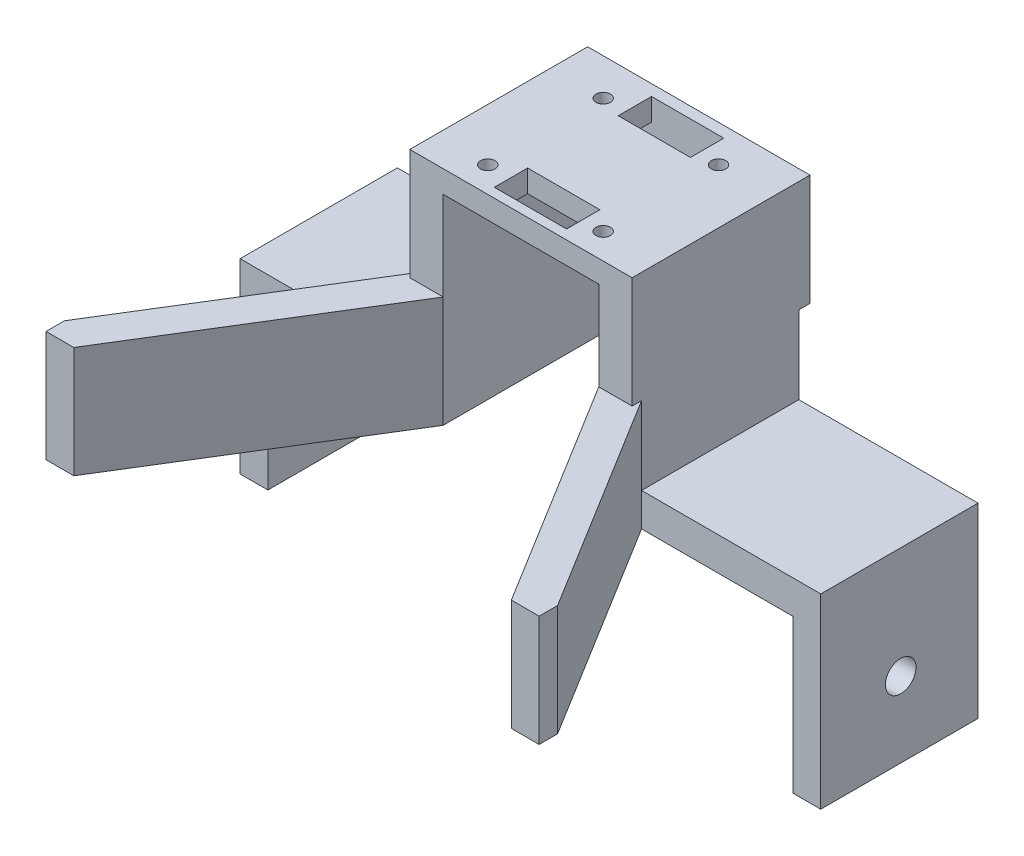
from build123d import *

# Parameters (mm, degrees)
BOSS_EXTRUDE1_DEPTH  = 25.4
SKETCH7_W            = 35.937578614
SKETCH7_H            = 7.62
BOSS_EXTRUDE3_DEPTH  = 40.95
SKETCH8_W            = 6.35
SKETCH8_H            = 35.937578614
BOSS_EXTRUDE4_DEPTH  = 35
SKETCH9_W            = 7.62
SKETCH9_H            = 35.937578614
BOSS_EXTRUDE5_DEPTH  = 25.4
BOSS_EXTRUDE6_REACH  = 135.462
SKETCH10_W           = 35.937578614
SKETCH10_H           = 5.08
CUT_EXTRUDE1_REACH   = 172.448
SKETCH11_W           = 16.51
SKETCH11_H           = 7.62
BOSS_EXTRUDE7_DEPTH  = 2.162419
SKETCH14_W           = 50.8
SKETCH14_H           = 25.4
BOSS_EXTRUDE9_DEPTH  = 2.54
M6_CLEARANCE_HOLE2_D = 7
CUT_EXTRUDE2_REACH   = 171.327
SKETCH18_R           = 1.651
SKETCH19_W           = 7.62
SKETCH19_H           = 16.51
CUT_EXTRUDE4_DEPTH   = 1.27


with BuildPart() as part:
    # Sketch1 → Boss-Extrude1 (new body)
    with BuildSketch(Plane(origin=(0, 0, 0), x_dir=(1, 0, 0), z_dir=(0, 1, 0))):
        Polygon((6.35, 4.219850082), (-24.6, 54.359549401), (-24.6, 90.297128015), (-32.22, 90.297128015), (-32.22, 52.197128015), (0, 0), (6.35, 0), align=None)
    extrude(amount=BOSS_EXTRUDE1_DEPTH)

    # Sketch7 → Boss-Extrude3 (add)
    with BuildSketch(Plane(origin=(-24.6, 0, 0), x_dir=(0, 0, -1), z_dir=(1, 0, 0))):
        with Locations((72.328338708, 3.81)):
            Rectangle(SKETCH7_W, SKETCH7_H)
    extrude(amount=BOSS_EXTRUDE3_DEPTH)

    # Sketch8 → Boss-Extrude4 (add)
    with BuildSketch(Plane.XZ):
        with Locations((13.175, -72.328338708)):
            Rectangle(SKETCH8_W, SKETCH8_H)
    extrude(amount=BOSS_EXTRUDE4_DEPTH)


with BuildPart() as body_2:
    # Mirror6: mirrored copy
    add(part.part.mirror(Plane.ZY.offset(50)))


with BuildPart() as part_1:
    add(part.part)

    add(body_2.part)  # Boss-Extrude5 merges body 2
    # Sketch9 → Boss-Extrude5 (add)
    with BuildSketch(Plane(origin=(0, 25.4, 0), x_dir=(1, 0, 0), z_dir=(0, 1, 0))):
        with Locations((-71.59, 72.328338708)):
            Rectangle(SKETCH9_W, SKETCH9_H)
        with Locations((-28.41, 72.328338708)):
            Rectangle(SKETCH9_W, SKETCH9_H)
    extrude(amount=BOSS_EXTRUDE5_DEPTH)

    # Sketch10 → Boss-Extrude6 (add, up to next)
    with BuildSketch(Plane(origin=(-67.78, 0, 0), x_dir=(0, 0, -1), z_dir=(1, 0, 0)), mode=Mode.PRIVATE) as boss_extrude6_sk1:
        with Locations((72.328338708, 48.26)):
            Rectangle(SKETCH10_W, SKETCH10_H)
    boss_extrude6_tool1 = extrude(boss_extrude6_sk1.sketch, amount=BOSS_EXTRUDE6_REACH, mode=Mode.PRIVATE) - part_1.part
    add(boss_extrude6_tool1.solids().sort_by_distance((-67.78, 48.26, -72.328339))[0])

    # Sketch11 → Cut-Extrude1 (cut, up to next)
    with BuildSketch(Plane(origin=(0, 50.8, 0), x_dir=(1, 0, 0), z_dir=(0, 1, 0)), mode=Mode.PRIVATE) as cut_extrude1_sk1:
        with Locations((-50, 58.169549401)):
            Rectangle(SKETCH11_W, SKETCH11_H)
    cut_extrude1_tool1 = extrude(cut_extrude1_sk1.sketch, amount=-CUT_EXTRUDE1_REACH, mode=Mode.PRIVATE) & part_1.part
    # Sketch11 → Cut-Extrude1 (cut, up to next)
    with BuildSketch(Plane(origin=(0, 50.8, 0), x_dir=(1, 0, 0), z_dir=(0, 1, 0)), mode=Mode.PRIVATE) as cut_extrude1_sk2:
        with Locations((-50, 86.487128015)):
            Rectangle(SKETCH11_W, SKETCH11_H)
    cut_extrude1_tool2 = extrude(cut_extrude1_sk2.sketch, amount=-CUT_EXTRUDE1_REACH, mode=Mode.PRIVATE) & part_1.part
    add(cut_extrude1_tool1.solids().sort_by_distance((-50, 50.8, -58.169549))[0], mode=Mode.SUBTRACT)
    add(cut_extrude1_tool2.solids().sort_by_distance((-50, 50.8, -86.487128))[0], mode=Mode.SUBTRACT)

    # Sketch12 → Boss-Extrude7 (add)
    with BuildSketch(Plane.XY.offset(-54.359549401)):
        Polygon((-75.4, 50.8), (-24.6, 50.8), (-24.6, 25.4), (-32.22, 25.4), (-32.22, 45.72), (-67.78, 45.72), (-67.78, 25.4), (-75.4, 25.4), align=None)
    extrude(amount=BOSS_EXTRUDE7_DEPTH)

    # Sketch14 → Boss-Extrude9 (add)
    with BuildSketch(Plane(origin=(0, 0, -90.297128015), x_dir=(-1, 0, 0), z_dir=(0, 0, -1))):
        with Locations((50, 38.1)):
            Rectangle(SKETCH14_W, SKETCH14_H)
    extrude(amount=BOSS_EXTRUDE9_DEPTH)

    # M6 Clearance Hole2 (through all)
    with Locations(Plane(origin=(16.35, 0, 0), x_dir=(0, 0, -1), z_dir=(1, 0, 0))):
        with Locations((72.633968015, -17.78)):
            Hole(M6_CLEARANCE_HOLE2_D / 2)

    # Sketch18 → Cut-Extrude2 (cut, up to next)
    with BuildSketch(Plane(origin=(0, 45.72, 0), x_dir=(-1, 0, 0), z_dir=(0, -1, 0)), mode=Mode.PRIVATE) as cut_extrude2_sk1:
        with Locations(Location((37.080244901, 58.064528015, 0), (0, 0, 90))):
            Circle(SKETCH18_R)
    cut_extrude2_tool1 = extrude(cut_extrude2_sk1.sketch, amount=-CUT_EXTRUDE2_REACH, mode=Mode.PRIVATE) & part_1.part
    # Sketch18 → Cut-Extrude2 (cut, up to next)
    with BuildSketch(Plane(origin=(0, 45.72, 0), x_dir=(-1, 0, 0), z_dir=(0, -1, 0)), mode=Mode.PRIVATE) as cut_extrude2_sk2:
        with Locations(Location((63.445444901, 58.064528015, 0), (0, 0, 90))):
            Circle(SKETCH18_R)
    cut_extrude2_tool2 = extrude(cut_extrude2_sk2.sketch, amount=-CUT_EXTRUDE2_REACH, mode=Mode.PRIVATE) & part_1.part
    # Sketch18 → Cut-Extrude2 (cut, up to next)
    with BuildSketch(Plane(origin=(0, 45.72, 0), x_dir=(-1, 0, 0), z_dir=(0, -1, 0)), mode=Mode.PRIVATE) as cut_extrude2_sk3:
        with Locations(Location((63.445444901, 84.429728015, 0), (0, 0, 90))):
            Circle(SKETCH18_R)
    cut_extrude2_tool3 = extrude(cut_extrude2_sk3.sketch, amount=-CUT_EXTRUDE2_REACH, mode=Mode.PRIVATE) & part_1.part
    # Sketch18 → Cut-Extrude2 (cut, up to next)
    with BuildSketch(Plane(origin=(0, 45.72, 0), x_dir=(-1, 0, 0), z_dir=(0, -1, 0)), mode=Mode.PRIVATE) as cut_extrude2_sk4:
        with Locations(Location((37.080244901, 84.429728015, 0), (0, 0, 90))):
            Circle(SKETCH18_R)
    cut_extrude2_tool4 = extrude(cut_extrude2_sk4.sketch, amount=-CUT_EXTRUDE2_REACH, mode=Mode.PRIVATE) & part_1.part
    add(cut_extrude2_tool1.solids().sort_by_distance((-37.080245, 45.72, -58.064528))[0], mode=Mode.SUBTRACT)
    add(cut_extrude2_tool2.solids().sort_by_distance((-63.445445, 45.72, -58.064528))[0], mode=Mode.SUBTRACT)
    add(cut_extrude2_tool3.solids().sort_by_distance((-63.445445, 45.72, -84.429728))[0], mode=Mode.SUBTRACT)
    add(cut_extrude2_tool4.solids().sort_by_distance((-37.080245, 45.72, -84.429728))[0], mode=Mode.SUBTRACT)

    # Sketch19 → Cut-Extrude4 (cut)
    with BuildSketch(Plane.XZ.offset(-45.72)):
        with Locations((-38.316, -72.327898015)):
            Rectangle(SKETCH19_W, SKETCH19_H)
        with Locations((-61.684, -72.327898015)):
            Rectangle(SKETCH19_W, SKETCH19_H)
    extrude(amount=-CUT_EXTRUDE4_DEPTH, mode=Mode.SUBTRACT)


solid = part_1.part
